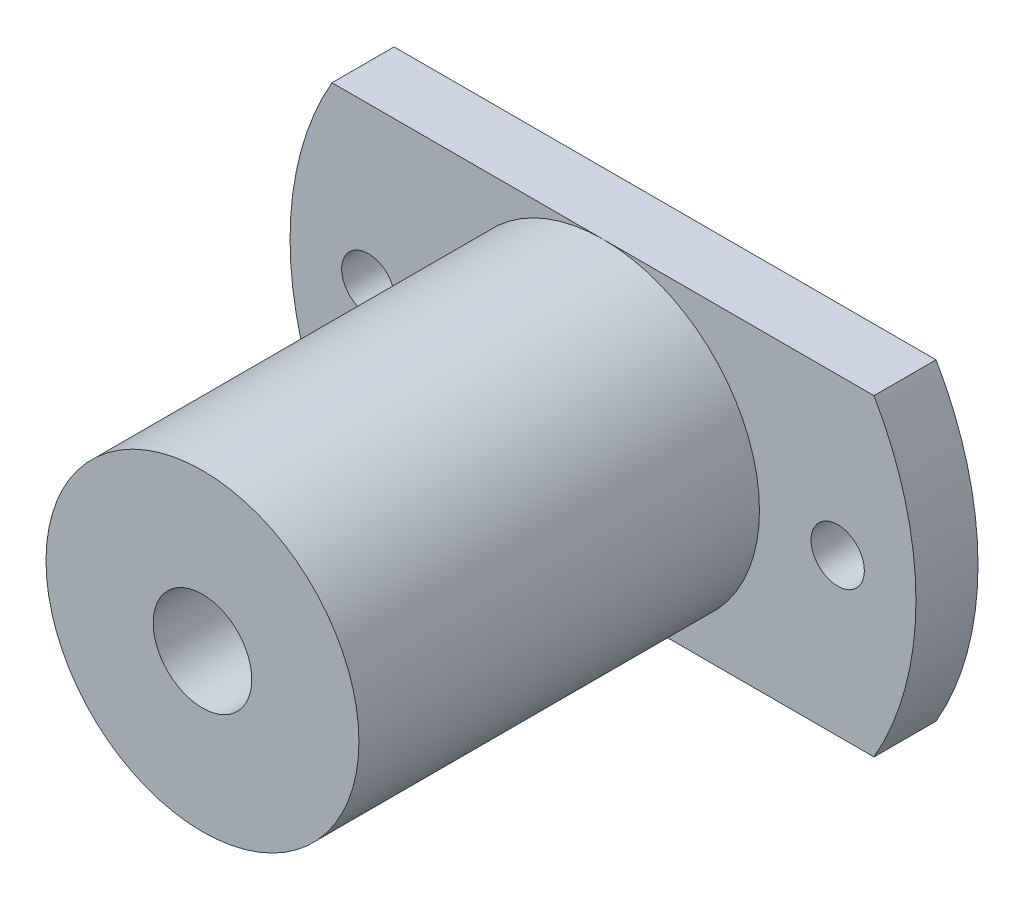
from build123d import *

# Parameters (mm, degrees)
SKETCH1_R                        = 15.875
BOSS_EXTRUDE1_DEPTH              = 23.4696
CUT_EXTRUDE1_START               = -20.32
SKETCH2_R                        = 15.875
SKETCH2_R_2                      = 7.9375
CUT_EXTRUDE1_DEPTH               = 20.32
M6X1_0_TAPPED_HOLE1_D            = 5
F_36_0_1065_DIAMETER_HOLE2_D     = 2.7051
F_36_0_1065_DIAMETER_HOLE2_DEPTH = 6.35
F_36_0_1065_DIAMETER_HOLE2_TIP   = 0.81269403
CUT_EXTRUDE2_DEPTH               = 31.280912305


with BuildPart() as part:
    # Sketch1 → Boss-Extrude1 (new body)
    with BuildSketch(Plane.XY):
        Circle(SKETCH1_R)
    extrude(amount=BOSS_EXTRUDE1_DEPTH)

    # Sketch2 → Cut-Extrude1 (cut)
    with BuildSketch(Plane.XY.offset(23.4696).offset(CUT_EXTRUDE1_START)):
        Circle(SKETCH2_R)
        Circle(SKETCH2_R_2, mode=Mode.SUBTRACT)
    extrude(amount=CUT_EXTRUDE1_DEPTH, mode=Mode.SUBTRACT)

    # M6x1.0 Tapped Hole1 (through all)
    with Locations(Plane.XY.offset(23.4696)):
        with Locations((0, 0)):
            Hole(M6X1_0_TAPPED_HOLE1_D / 2)

    # #36 (0.1065) Diameter Hole2
    with Locations(Plane.XY.offset(3.1496)):
        with Locations((11.90625, 0), (-11.90625, 0)):
            Hole(F_36_0_1065_DIAMETER_HOLE2_D / 2, depth=F_36_0_1065_DIAMETER_HOLE2_DEPTH)
            with Locations((0, 0, -(F_36_0_1065_DIAMETER_HOLE2_DEPTH + F_36_0_1065_DIAMETER_HOLE2_TIP / 2))):  # 118° drill point
                Cone(0, F_36_0_1065_DIAMETER_HOLE2_D / 2, F_36_0_1065_DIAMETER_HOLE2_TIP, mode=Mode.SUBTRACT)

    # Sketch8 → Cut-Extrude2 (cut, through all)
    with BuildSketch(Plane.XY.offset(3.1496)):
        with BuildLine():
            Line((0, 7.9375), (-13.748153285, 7.9375))
            ThreePointArc((-13.748153285, 7.9375), (0, 15.875), (13.748153285, 7.9375))
            Line((13.748153285, 7.9375), (0, 7.9375))
        make_face()
        with BuildLine():
            Line((-13.748153285, -7.9375), (13.748153285, -7.9375))
            ThreePointArc((13.748153285, -7.9375), (0, -15.875), (-13.748153285, -7.9375))
        make_face()
    extrude(amount=-CUT_EXTRUDE2_DEPTH, mode=Mode.SUBTRACT)


solid = part.part
